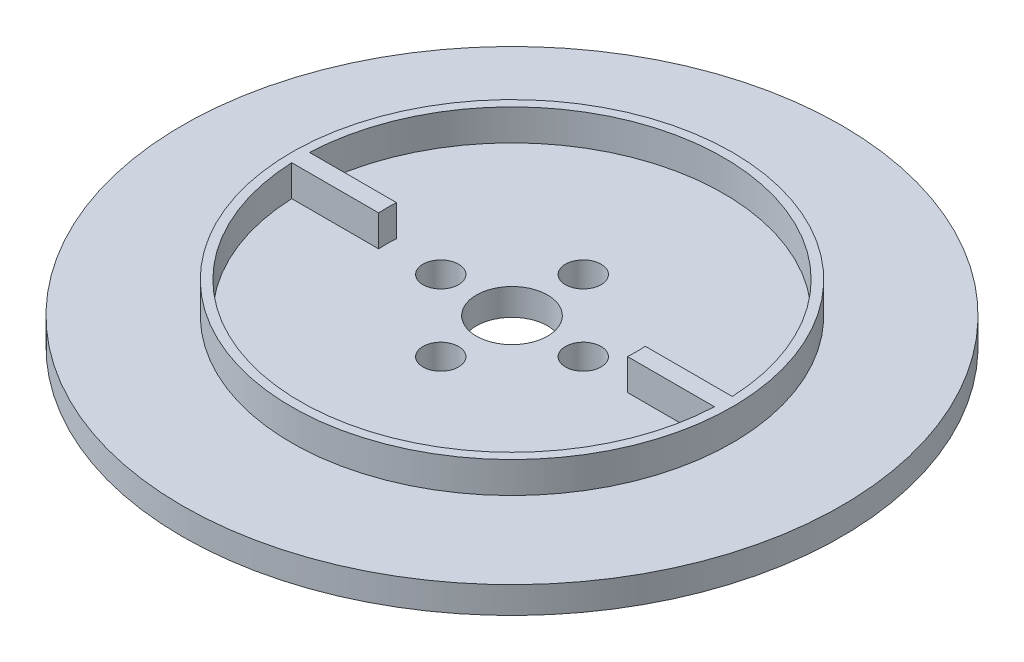
from build123d import *

# Parameters (mm, degrees)
SKETCH1_R           = 37
BOSS_EXTRUDE1_DEPTH = 3
SKETCH1_3_R         = 24.75
BOSS_EXTRUDE2_DEPTH = 6.5
SKETCH3_R           = 4
SKETCH3_R_2         = 2
CUT_EXTRUDE1_DEPTH  = 6.5


with BuildPart() as part:
    # Sketch1 → Boss-Extrude1 (new body)
    with BuildSketch(Plane(origin=(0, 0, 0), x_dir=(1, 0, 0), z_dir=(0, 1, 0))):
        Circle(SKETCH1_R)
    extrude(amount=BOSS_EXTRUDE1_DEPTH)

    # Sketch1<3> → Boss-Extrude2 (add)
    with BuildSketch(Plane(origin=(0, 0, 0), x_dir=(1, 0, 0), z_dir=(0, 1, 0))):
        Circle(SKETCH1_3_R)
        with BuildLine():
            ThreePointArc((-23.728938029, 1), (0, 23.75), (23.728938029, 1))
            Line((23.728938029, 1), (13.964240044, 1))
            ThreePointArc((13.964240044, 1), (14, 0), (13.964240044, -1))
            Line((13.964240044, -1), (23.728938029, -1))
            ThreePointArc((23.728938029, -1), (0, -23.75), (-23.728938029, -1))
            Line((-23.728938029, -1), (-13.964240044, -1))
            ThreePointArc((-13.964240044, -1), (-14, 0), (-13.964240044, 1))
            Line((-13.964240044, 1), (-23.728938029, 1))
        make_face(mode=Mode.SUBTRACT)
    extrude(amount=BOSS_EXTRUDE2_DEPTH)

    # Sketch3 → Cut-Extrude1 (cut)
    with BuildSketch(Plane(origin=(0, 3, 0), x_dir=(1, 0, 0), z_dir=(0, 1, 0))):
        Circle(SKETCH3_R)
        with Locations((8, 0)):
            Circle(SKETCH3_R_2)
        with Locations((0, -8)):
            Circle(SKETCH3_R_2)
        with Locations((-8, 0)):
            Circle(SKETCH3_R_2)
        with Locations((0, 8)):
            Circle(SKETCH3_R_2)
    extrude(amount=-CUT_EXTRUDE1_DEPTH, mode=Mode.SUBTRACT)


solid = part.part
